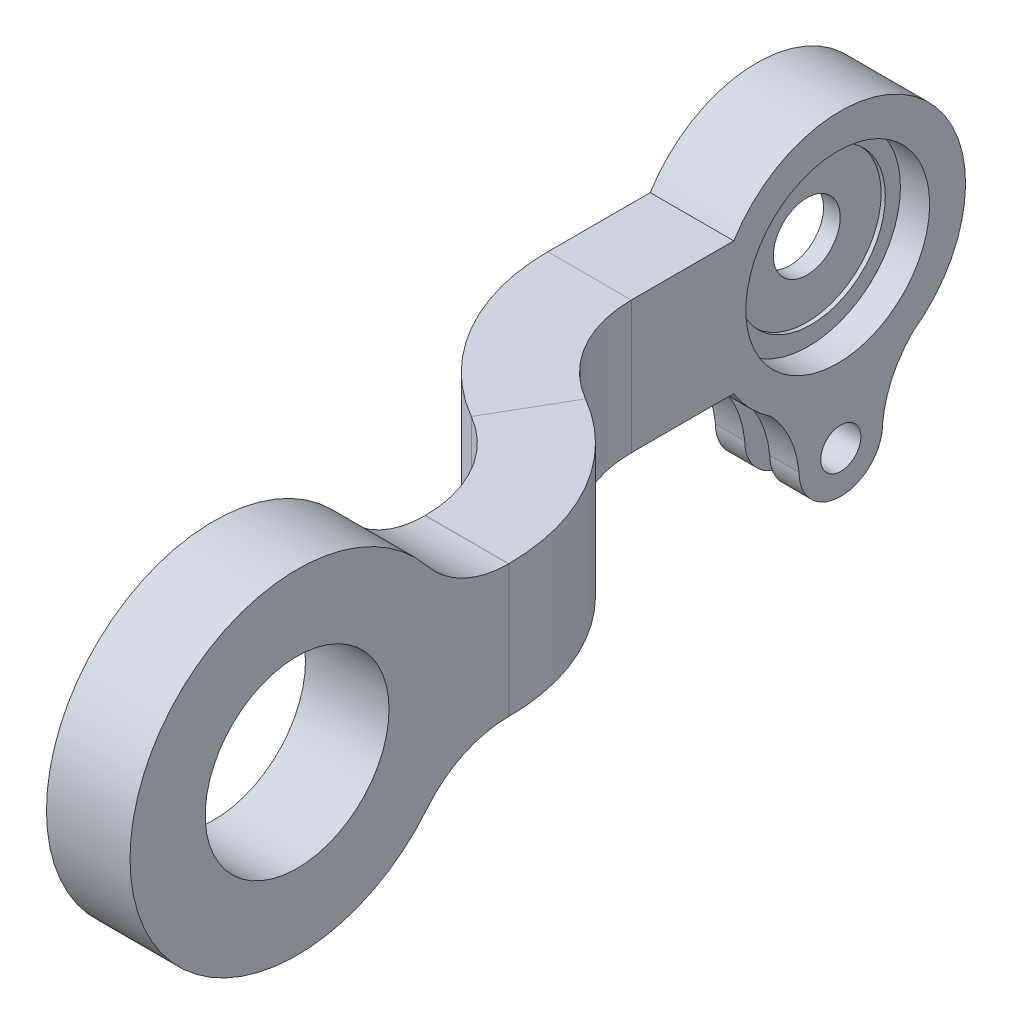
from build123d import *

# Parameters (mm, degrees)
CROQUIS2_W              = 10
CROQUIS2_H              = 15.834903248
CROQUIS4_R              = 15
SALIENTE_EXTRUIR1_DEPTH = 10
CROQUIS5_R              = 20
SALIENTE_EXTRUIR2_DEPTH = 10
SALIENTE_EXTRUIR5_DEPTH = 3.5
CROQUIS13_R             = 2.5
CORTAR_EXTRUIR1_DEPTH   = 10
SIMETR_A3_COPY_1_DEPTH  = 3.5
CORTAR_EXTRUIR5_DEPTH   = 10
CROQUIS21_R             = 2.4
CORTAR_EXTRUIR6_DEPTH   = 10
CROQUIS7_R              = 11
CORTAR_EXTRUIR7_DEPTH   = 10
REDONDEO1_R             = 12.5
REDONDEO2_R             = 12.5
CROQUIS22_R             = 11.5
CORTAR_EXTRUIR8_DEPTH   = 4
CROQUIS6_R              = 4
CORTAR_EXTRUIR9_DEPTH   = 8
CROQUIS23_R             = 11
CORTAR_EXTRUIR10_DEPTH  = 4
CROQUIS24_R             = 11.295388062
CROQUIS24_R_2           = 8.9
SALIENTE_EXTRUIR6_DEPTH = 0.5
SALIENTE_EXTRUIR7_START = 0.5
CROQUIS25_R             = 11.5
CROQUIS25_R_2           = 8.9
SALIENTE_EXTRUIR7_DEPTH = 0.5


with BuildPart() as part:
    # Barrer1: sweep along a path in Croquis1
    with BuildLine(Plane(origin=(0, 0, 0), x_dir=(1, 0, 0), z_dir=(0, 1, 0))) as barrer1_path:
        Line((-20, 85), (-20, 60))
        ThreePointArc((-20, 60), (-17.320508076, 50), (-10, 42.679491924))
        ThreePointArc((-10, 42.679491924), (-2.679491924, 35.358983849), (0, 25.358983849))
        Line((0, 25.358983849), (0, 0))
    # Croquis2 → Barrer1 (sweep)
    with BuildSketch(Plane.XY):
        Rectangle(CROQUIS2_W, CROQUIS2_H)
    sweep(path=barrer1_path.line)

    # Croquis4 → Saliente-Extruir1 (add)
    with BuildSketch(Plane(origin=(-15, 0, 0), x_dir=(0, 0, -1), z_dir=(1, 0, 0))):
        with Locations((85, 0)):
            Circle(CROQUIS4_R)
    extrude(amount=-SALIENTE_EXTRUIR1_DEPTH)

    # Croquis5 → Saliente-Extruir2 (add)
    with BuildSketch(Plane(origin=(5, 0, 0), x_dir=(0, 0, -1), z_dir=(1, 0, 0))):
        Circle(CROQUIS5_R)
    extrude(amount=-SALIENTE_EXTRUIR2_DEPTH)

    # Croquis12 → Saliente-Extruir5 (add)
    with BuildSketch(Plane(origin=(-15, 0, 0), x_dir=(0, 0, -1), z_dir=(1, 0, 0))):
        with BuildLine():
            ThreePointArc((90.068496439, 19.972615481), (85.068496439, 24.972615481), (80.068496439, 19.972615481))
            add(Edge.make_bspline(
                [(80.068496439, 19.972615481), (79.566731031, 15.028252388), (75.848465439, 11.643922813)],
                knots=[0, 0, 0, 1, 1, 1], degree=2))
            ThreePointArc((75.848465439, 11.643922813), (85.068496439, 14.846363713), (94.288527439, 11.643922813))
            add(Edge.make_bspline(
                [(90.068496439, 19.972615481), (90.570261847, 15.028252388), (94.288527439, 11.643922813)],
                knots=[0, 0, 0, 1, 1, 1], degree=2))
        make_face()
    saliente_extruir5 = extrude(amount=-SALIENTE_EXTRUIR5_DEPTH)

    # Simetría1: Saliente-Extruir5 across plane
    add(saliente_extruir5.mirror(Plane(origin=(-20, 0, 0), x_dir=(0, 0, 1), z_dir=(1, 0, 0))))

    # Croquis13 → Cortar-Extruir1 (cut)
    with BuildSketch(Plane(origin=(-15, 0, 0), x_dir=(0, 0, -1), z_dir=(1, 0, 0))):
        with Locations((85.068496439, 19.972615481)):
            Circle(CROQUIS13_R)
    extrude(amount=-CORTAR_EXTRUIR1_DEPTH, mode=Mode.SUBTRACT)

    # Simetría3: Saliente-Extruir5 across plane
    add(saliente_extruir5.mirror(Plane.ZX))

    # Simetría3 copy 1 sketch → Simetría3 copy 1 (add)
    with BuildSketch(Plane(origin=(-25, 0, 0), x_dir=(0, 0, -1), z_dir=(-1, 0, 0))):
        with BuildLine():
            ThreePointArc((90.068496439, 19.972615481), (85.068496439, 24.972615481), (80.068496439, 19.972615481))
            add(Edge.make_bspline(
                [(80.068496439, 19.972615481), (79.566731031, 15.028252388), (75.848465439, 11.643922813)],
                knots=[0, 0, 0, 1, 1, 1], degree=2))
            ThreePointArc((75.848465439, 11.643922813), (85.068496439, 14.846363713), (94.288527439, 11.643922813))
            add(Edge.make_bspline(
                [(90.068496439, 19.972615481), (90.570261847, 15.028252388), (94.288527439, 11.643922813)],
                knots=[0, 0, 0, 1, 1, 1], degree=2))
        make_face()
    extrude(amount=-SIMETR_A3_COPY_1_DEPTH)

    # Croquis20 → Cortar-Extruir5 (cut)
    with BuildSketch(Plane(origin=(-15, 0, 0), x_dir=(0, 0, -1), z_dir=(1, 0, 0))):
        with BuildLine():
            Line((75.916830569, 25.735778906), (95.172377376, 25.735778906))
            Line((95.172377376, 25.735778906), (95.172377376, 11.023735234))
            ThreePointArc((95.172377376, 11.023735234), (85.710763224, 14.983151058), (75.916830569, 11.93717023))
            Line((75.916830569, 11.93717023), (75.916830569, 25.735778906))
        make_face()
    extrude(amount=-CORTAR_EXTRUIR5_DEPTH, mode=Mode.SUBTRACT)

    # Croquis21 → Cortar-Extruir6 (cut)
    with BuildSketch(Plane.ZY.offset(25)):
        with Locations((-85.068496439, -19.972615481)):
            Circle(CROQUIS21_R)
    extrude(amount=-CORTAR_EXTRUIR6_DEPTH, mode=Mode.SUBTRACT)

    # Croquis7 → Cortar-Extruir7 (cut)
    with BuildSketch(Plane(origin=(5, 0, 0), x_dir=(0, 0, -1), z_dir=(1, 0, 0))):
        Circle(CROQUIS7_R)
    extrude(amount=-CORTAR_EXTRUIR7_DEPTH, mode=Mode.SUBTRACT)

    # Redondeo1
    redondeo1_edges = [part.edges().sort_by_distance(p)[0] for p in [
        (0, -7.917451624, -18.366108999),
    ]]
    fillet(redondeo1_edges, radius=REDONDEO1_R)

    # Redondeo2
    redondeo2_edges = [part.edges().sort_by_distance(p)[0] for p in [
        (0, 7.917451624, -18.366108999),
    ]]
    fillet(redondeo2_edges, radius=REDONDEO2_R)

    # Croquis22 → Cortar-Extruir8 (cut)
    with BuildSketch(Plane.ZY.offset(25)):
        with Locations((-85, 0)):
            Circle(CROQUIS22_R)
    extrude(amount=-CORTAR_EXTRUIR8_DEPTH, mode=Mode.SUBTRACT)

    # Croquis6 → Cortar-Extruir9 (cut)
    with BuildSketch(Plane(origin=(-15, 0, 0), x_dir=(0, 0, -1), z_dir=(1, 0, 0))):
        with Locations((85, 0)):
            Circle(CROQUIS6_R)
    extrude(amount=-CORTAR_EXTRUIR9_DEPTH, mode=Mode.SUBTRACT)

    # Croquis23 → Cortar-Extruir10 (cut)
    with BuildSketch(Plane(origin=(-15, 0, 0), x_dir=(0, 0, -1), z_dir=(1, 0, 0))):
        with Locations((84.704611938, 0)):
            Circle(CROQUIS23_R)
    extrude(amount=-CORTAR_EXTRUIR10_DEPTH, mode=Mode.SUBTRACT)

    # Croquis24 → Saliente-Extruir6 (add)
    with BuildSketch(Plane(origin=(-19, 0, 0), x_dir=(0, 0, -1), z_dir=(1, 0, 0))):
        with Locations((85, 0)):
            Circle(CROQUIS24_R)
        with Locations((85, 0)):
            Circle(CROQUIS24_R_2, mode=Mode.SUBTRACT)
    extrude(amount=SALIENTE_EXTRUIR6_DEPTH)

    # Croquis25 → Saliente-Extruir7 (add)
    with BuildSketch(Plane.ZY.offset(21).offset(SALIENTE_EXTRUIR7_START)):
        with Locations((-85, 0)):
            Circle(CROQUIS25_R)
        with Locations(Location((-85, 0, 0), (0, 0, 180))):
            Circle(CROQUIS25_R_2, mode=Mode.SUBTRACT)
    extrude(amount=-SALIENTE_EXTRUIR7_DEPTH)


solid = part.part
